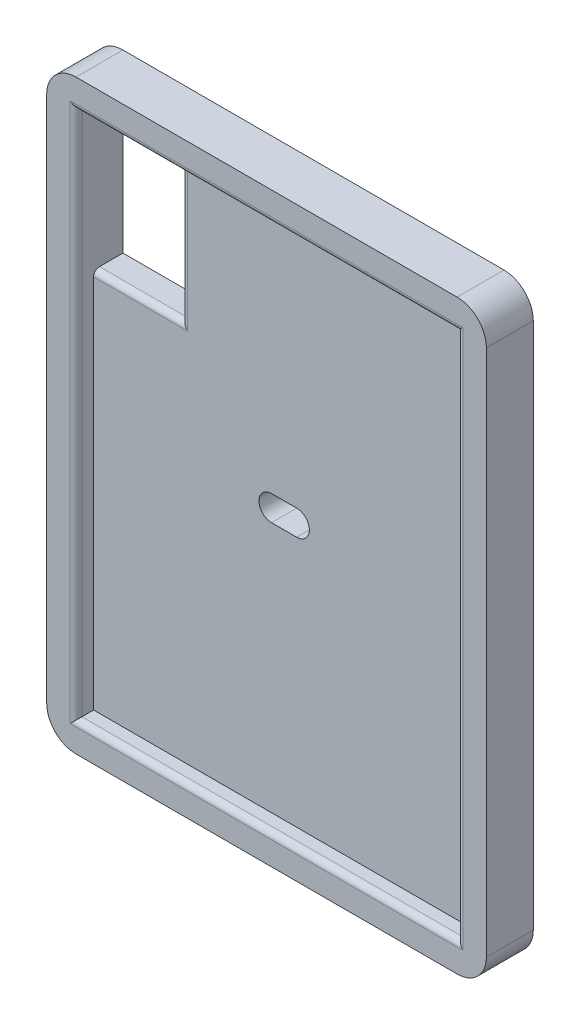
from build123d import *

# Parameters (mm, degrees)
SKETCH1_W           = 100
SKETCH1_H           = 75
BOSS_EXTRUDE1_DEPTH = 5
SKETCH2_W           = 75
SKETCH2_H           = 100
SKETCH2_W_2         = 65
SKETCH2_H_2         = 90
BOSS_EXTRUDE2_DEPTH = 3
SKETCH3_W           = 15
SKETCH3_H           = 25
CUT_EXTRUDE1_DEPTH  = 63.69968102
FILLET1_R           = 5
FILLET2_R           = 1


with BuildPart() as part:
    # Sketch1 → Boss-Extrude1 (new body)
    with BuildSketch(Plane(origin=(0, 0, 0), x_dir=(0, 1, 0), z_dir=(0, 0, 1))):
        Rectangle(SKETCH1_W, SKETCH1_H)
    extrude(amount=BOSS_EXTRUDE1_DEPTH)

    # Sketch2 → Boss-Extrude2 (add)
    with BuildSketch(Plane.XY.offset(5)):
        Rectangle(SKETCH2_W, SKETCH2_H)
        Rectangle(SKETCH2_W_2, SKETCH2_H_2, mode=Mode.SUBTRACT)
    extrude(amount=BOSS_EXTRUDE2_DEPTH)

    # Sketch3 → Cut-Extrude1 (cut, through all)
    with BuildSketch(Plane.XY.offset(5)):
        with Locations((-25, 32.5)):
            Rectangle(SKETCH3_W, SKETCH3_H)
        with BuildLine():
            Line((-2.15, 2.15), (2.15, 2.15))
            ThreePointArc((2.15, 2.15), (4.3, 0), (2.15, -2.15))
            Line((2.15, -2.15), (-2.15, -2.15))
            ThreePointArc((-2.15, -2.15), (-4.3, 0), (-2.15, 2.15))
        make_face()
    extrude(amount=-CUT_EXTRUDE1_DEPTH, mode=Mode.SUBTRACT)

    # Fillet1
    fillet1_edges = [part.edges().sort_by_distance(p)[0] for p in [
        (37.5, 50, 4),
        (37.5, -50, 4),
        (-37.5, -50, 4),
        (-37.5, 50, 4),
    ]]
    fillet(fillet1_edges, radius=FILLET1_R)

    # Fillet2
    fillet2_edges = [part.edges().sort_by_distance(p)[0] for p in [
        (32.5, 0, 8),
        (0, 45, 8),
        (-32.5, 0, 8),
        (0, -45, 8),
        (-25, 20, 5),
        (-17.5, 32.5, 5),
    ]]
    fillet(fillet2_edges, radius=FILLET2_R)


solid = part.part
